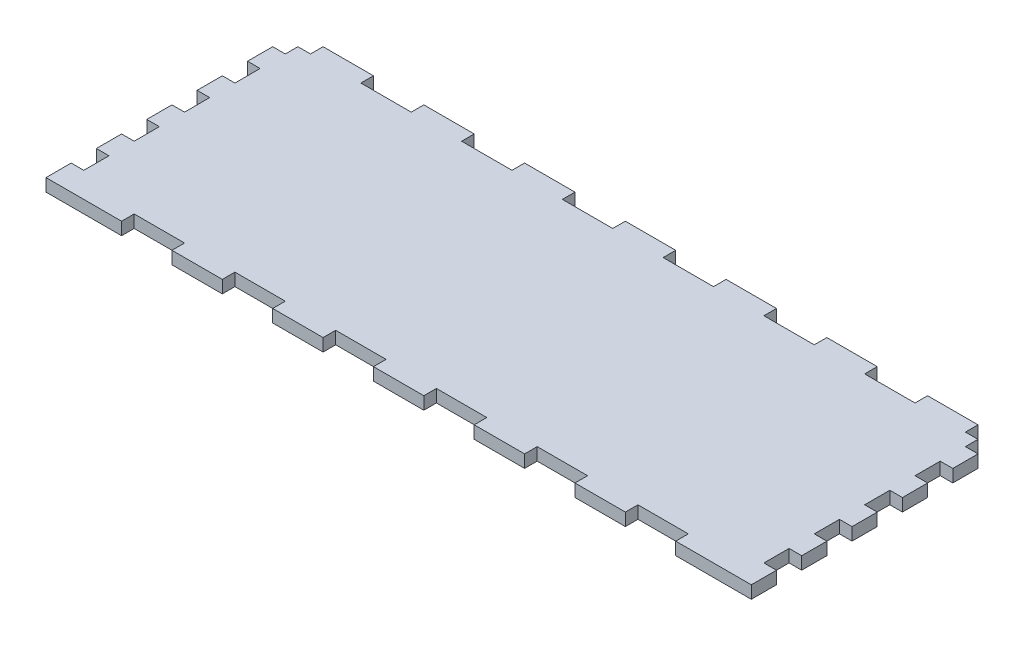
from build123d import *

# Parameters (mm, degrees)
ESQUISSE1_W                     = 355.6
ESQUISSE1_H                     = 127
BOSS_EXTRU_1_DEPTH              = 6.35
ESQUISSE3_W                     = 25.4
ESQUISSE3_H                     = 6.35
ENL_V_MAT_EXTRU_2_DEPTH         = 6.35
ESQUISSE4_W                     = 6.35
ESQUISSE4_H                     = 12.7
ENL_V_MAT_EXTRU_3_DEPTH         = 25.4
R_P_TITION_LIN_AIRE1_COUNT      = 6
R_P_TITION_LIN_AIRE1_PITCH      = 50.8
R_P_TITION_LIN_AIRE1_COUNT_DIR2 = 2
R_P_TITION_LIN_AIRE1_PITCH_DIR2 = 120.65
R_P_TITION_LIN_AIRE3_COUNT      = 5
R_P_TITION_LIN_AIRE3_PITCH      = 25.4
R_P_TITION_LIN_AIRE3_COUNT_DIR2 = 2
R_P_TITION_LIN_AIRE3_PITCH_DIR2 = 349.25
ESQUISSE5_W                     = 12.7
ESQUISSE5_H                     = 6.35
ENL_V_MAT_EXTRU_4_DEPTH         = 6.35


with BuildPart() as part:
    # Esquisse1 → Boss.-Extru.1 (new body)
    with BuildSketch(Plane(origin=(0, 0, 0), x_dir=(1, 0, 0), z_dir=(0, 1, 0))):
        Rectangle(ESQUISSE1_W, ESQUISSE1_H)
    extrude(amount=BOSS_EXTRU_1_DEPTH)

    # Esquisse3 → Enlèv. mat.-Extru.2 (cut)
    with BuildSketch(Plane(origin=(0, 6.35, 0), x_dir=(1, 0, 0), z_dir=(0, 1, 0))):
        with Locations((-127, 60.325)):
            Rectangle(ESQUISSE3_W, ESQUISSE3_H)
    enl_v_mat_extru_2 = extrude(amount=-ENL_V_MAT_EXTRU_2_DEPTH, mode=Mode.SUBTRACT)

    # Esquisse4 → Enlèv. mat.-Extru.3 (cut)
    with BuildSketch(Plane(origin=(0, 6.35, 0), x_dir=(1, 0, 0), z_dir=(0, 1, 0))):
        with Locations((-174.625, 57.15)):
            Rectangle(ESQUISSE4_W, ESQUISSE4_H)
    enl_v_mat_extru_3 = extrude(amount=-ENL_V_MAT_EXTRU_3_DEPTH, mode=Mode.SUBTRACT)

    # Répétition linéaire1: Enl_v. mat.-Extru.2 6 × 2
    with Locations(*[(i * R_P_TITION_LIN_AIRE1_PITCH, 0, j * R_P_TITION_LIN_AIRE1_PITCH_DIR2) for i in range(R_P_TITION_LIN_AIRE1_COUNT) for j in range(R_P_TITION_LIN_AIRE1_COUNT_DIR2) if (i, j) != (0, 0)]):
        add(enl_v_mat_extru_2, mode=Mode.SUBTRACT)

    # Répétition linéaire3: Enl_v. mat.-Extru.3 5 × 2
    with Locations(*[(j * R_P_TITION_LIN_AIRE3_PITCH_DIR2, 0, i * R_P_TITION_LIN_AIRE3_PITCH) for i in range(R_P_TITION_LIN_AIRE3_COUNT) for j in range(R_P_TITION_LIN_AIRE3_COUNT_DIR2) if (i, j) != (0, 0)]):
        add(enl_v_mat_extru_3, mode=Mode.SUBTRACT)

    # Esquisse5 → Enlèv. mat.-Extru.4 (cut)
    with BuildSketch(Plane(origin=(0, 6.35, 0), x_dir=(1, 0, 0), z_dir=(0, 1, 0))):
        with Locations((-171.45, 60.325)):
            Rectangle(ESQUISSE5_W, ESQUISSE5_H)
        with Locations((171.45, 60.325)):
            Rectangle(ESQUISSE5_W, ESQUISSE5_H)
    extrude(amount=-ENL_V_MAT_EXTRU_4_DEPTH, mode=Mode.SUBTRACT)


solid = part.part
